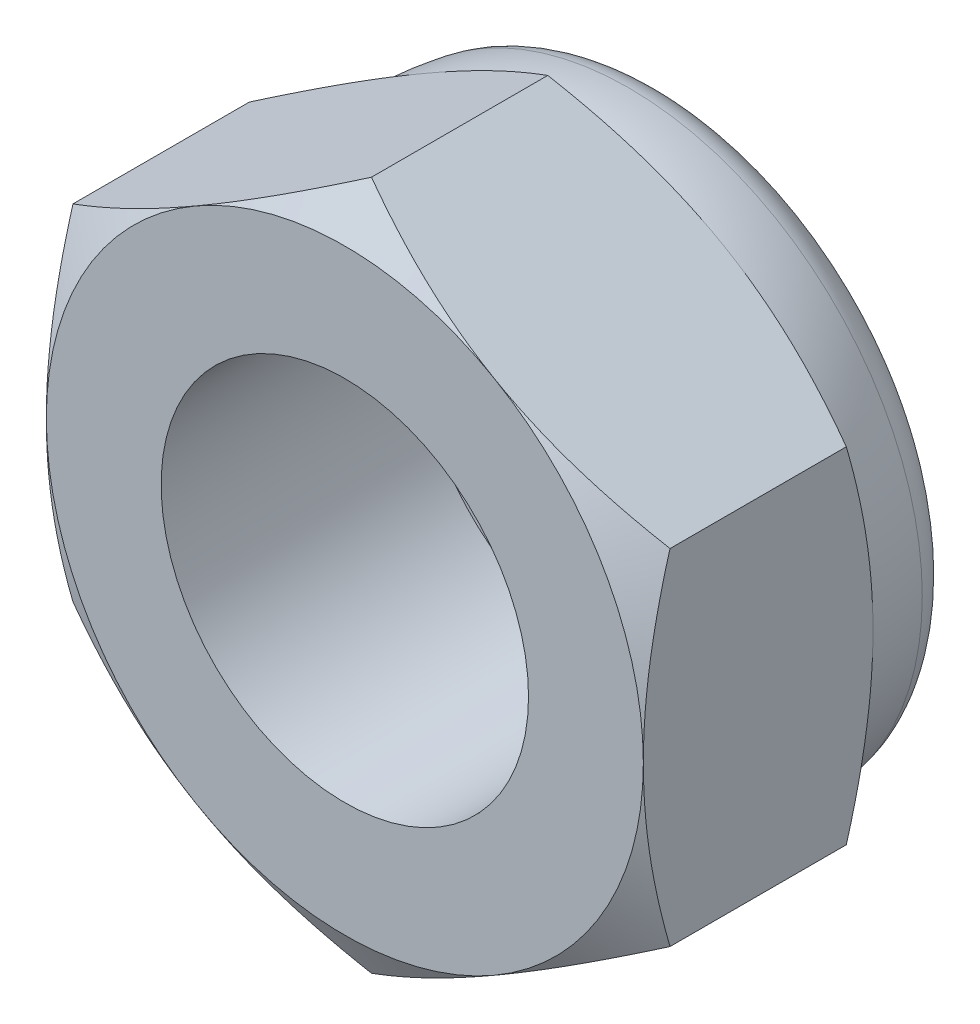
from build123d import *

# Parameters (mm, degrees)
BASE_EXTRUSION_DEPTH    = 5
ENL_V_MAT_EXTRU_2_DEPTH = 13.148388096
CONG_1_R                = 1
ESQUISSE3_R             = 4
ENL_V_MAT_EXTRU_1_DEPTH = 13.148388154
ESQUISSE6_W             = 0.5
ESQUISSE6_H             = 1.5


with BuildPart() as part:
    # Esquisse1 → Base-Extrusion (new body)
    with BuildSketch(Plane.XY):
        Polygon((6.5, -3.75277675), (6.5, 3.75277675), (0, 7.505553499), (-6.5, 3.75277675), (-6.5, -3.75277675), (0, -7.505553499), align=None)
    extrude(amount=-BASE_EXTRUSION_DEPTH)

    # Esquisse2 → Enlèvement de matière-Révolution1 (revolve, cut)
    with BuildSketch(Plane(origin=(0, 0, 0), x_dir=(1, 0, 0), z_dir=(0, 1, 0))):
        Polygon((-6.5, 0), (-11.830127019, 0), (-11.830127019, 5), (-6.5, 5), (-10.830127019, 2.5), align=None)
    revolve(axis=Axis((0, 0, -5), (0, 0, 1)), mode=Mode.SUBTRACT)

    # Esquisse4 → Boss.-Révol.1 (revolve)
    with BuildSketch(Plane(origin=(0, 0, 0), x_dir=(1, 0, 0), z_dir=(0, 1, 0))):
        with BuildLine():
            Line((0, 11.5), (0, 5))
            Line((0, 5), (-6.5, 5))
            ThreePointArc((-6.5, 5), (-4.596194078, 9.596194078), (0, 11.5))
        make_face()
    revolve(axis=Axis((0, 0, 0), (0, 0, -1)))

    # Esquisse5 → Enlèv. mat.-Extru.2 (cut, through all)
    with BuildSketch(Plane.XY.offset(-7)):
        with BuildLine():
            ThreePointArc((6.5, 0), (5.629165125, 3.25), (3.25, 5.629165125))
            ThreePointArc((3.25, 5.629165125), (0, 6.5), (-3.25, 5.629165125))
            ThreePointArc((-3.25, 5.629165125), (-5.629165125, 3.25), (-6.5, 0))
            ThreePointArc((-6.5, 0), (-5.629165125, -3.25), (-3.25, -5.629165125))
            ThreePointArc((-3.25, -5.629165125), (0, -6.5), (3.25, -5.629165125))
            ThreePointArc((3.25, -5.629165125), (5.629165125, -3.25), (6.5, 0))
        make_face()
    extrude(amount=-ENL_V_MAT_EXTRU_2_DEPTH, mode=Mode.SUBTRACT)

    # Congé1
    cong_1_edges = [part.edges().sort_by_distance(p)[0] for p in [
        (6.184658438, 0, -7),
    ]]
    fillet(cong_1_edges, radius=CONG_1_R)

    # Esquisse3 → Enlèv. mat.-Extru.1 (cut, through all)
    with BuildSketch(Plane.XY):
        Circle(ESQUISSE3_R)
    extrude(amount=-ENL_V_MAT_EXTRU_1_DEPTH, mode=Mode.SUBTRACT)

    # Esquisse6 → Révolution2 (revolve)
    with BuildSketch(Plane(origin=(0, 0, 0), x_dir=(1, 0, 0), z_dir=(0, 1, 0))):
        with Locations((3.75, 6.35)):
            Rectangle(ESQUISSE6_W, ESQUISSE6_H)
    revolve(axis=Axis((0, 0, -32.444892216), (0, 0, 1)))


solid = part.part
